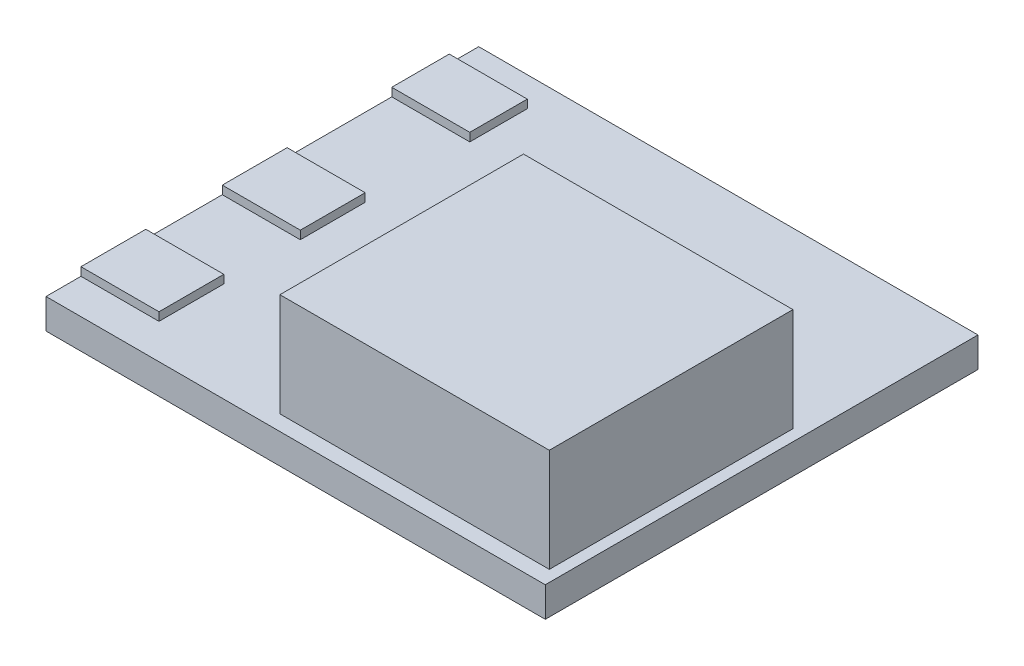
from build123d import *

# Parameters (mm, degrees)
SKETCH1_W           = 30
SKETCH1_H           = 26
BOSS_EXTRUDE1_DEPTH = 1.8
SKETCH1_3_W         = 16.187399031
SKETCH1_3_H         = 14.6365105
BOSS_EXTRUDE2_DEPTH = 8
SKETCH2_W           = 4.688292782
SKETCH2_H           = 3.45561668
SKETCH2_H_2         = 3.896759234
BOSS_EXTRUDE3_DEPTH = 0.5


with BuildPart() as part:
    # Sketch1 → Boss-Extrude1 (new body)
    with BuildSketch(Plane(origin=(0, 0, 0), x_dir=(1, 0, 0), z_dir=(0, 1, 0))):
        with Locations((15, 13)):
            Rectangle(SKETCH1_W, SKETCH1_H)
    extrude(amount=BOSS_EXTRUDE1_DEPTH)

    # Sketch1<3> → Boss-Extrude2 (add)
    with BuildSketch(Plane(origin=(0, 0, 0), x_dir=(1, 0, 0), z_dir=(0, 1, 0))):
        with Locations((21.227786753, 8.239095315)):
            Rectangle(SKETCH1_3_W, SKETCH1_3_H)
    extrude(amount=BOSS_EXTRUDE2_DEPTH)

    # Sketch2 → Boss-Extrude3 (add)
    with BuildSketch(Plane(origin=(0, 1.8, 0), x_dir=(1, 0, 0), z_dir=(0, 1, 0))):
        with Locations((2.344146391, 22.502945868)):
            Rectangle(SKETCH2_W, SKETCH2_H)
        with Locations((2.344146391, 12.540476505)):
            Rectangle(SKETCH2_W, SKETCH2_H_2)
        with Locations((2.344146391, 4.048482326)):
            Rectangle(SKETCH2_W, SKETCH2_H_2)
    extrude(amount=BOSS_EXTRUDE3_DEPTH)


solid = part.part
